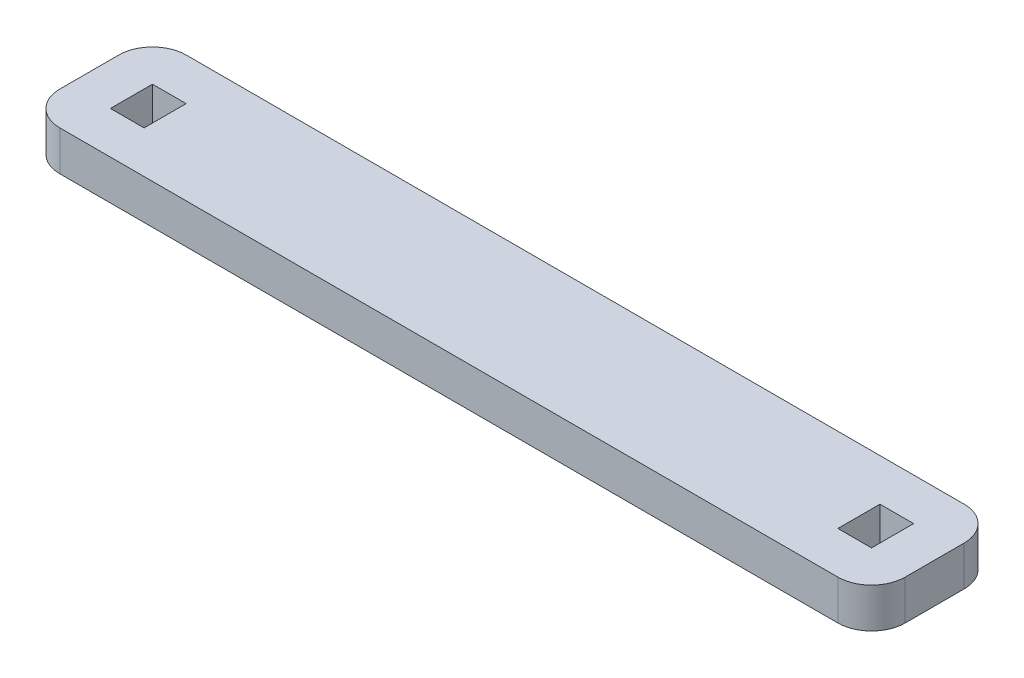
from build123d import *

# Parameters (mm, degrees)
SKETCH1_W           = 63.754
SKETCH1_H           = 9.525
SKETCH1_W_2         = 2.54
SKETCH1_H_2         = 3.175
BOSS_EXTRUDE1_DEPTH = 1.5
FILLET1_R           = 2.54


with BuildPart() as part:
    # Sketch1 → Boss-Extrude1 (new, symmetric)
    with BuildSketch(Plane(origin=(0, 0, 0), x_dir=(1, 0, 0), z_dir=(0, 1, 0))):
        Rectangle(SKETCH1_W, SKETCH1_H)
        with Locations((-27.432, 0)):
            Rectangle(SKETCH1_W_2, SKETCH1_H_2, mode=Mode.SUBTRACT)
        with Locations((27.432, 0)):
            Rectangle(SKETCH1_W_2, SKETCH1_H_2, mode=Mode.SUBTRACT)
    extrude(amount=BOSS_EXTRUDE1_DEPTH, both=True)

    # Fillet1
    fillet1_edges = [part.edges().sort_by_distance(p)[0] for p in [
        (-31.877, 0, -4.7625),
        (31.877, 0, -4.7625),
        (31.877, 0, 4.7625),
        (-31.877, 0, 4.7625),
    ]]
    fillet(fillet1_edges, radius=FILLET1_R)


solid = part.part
